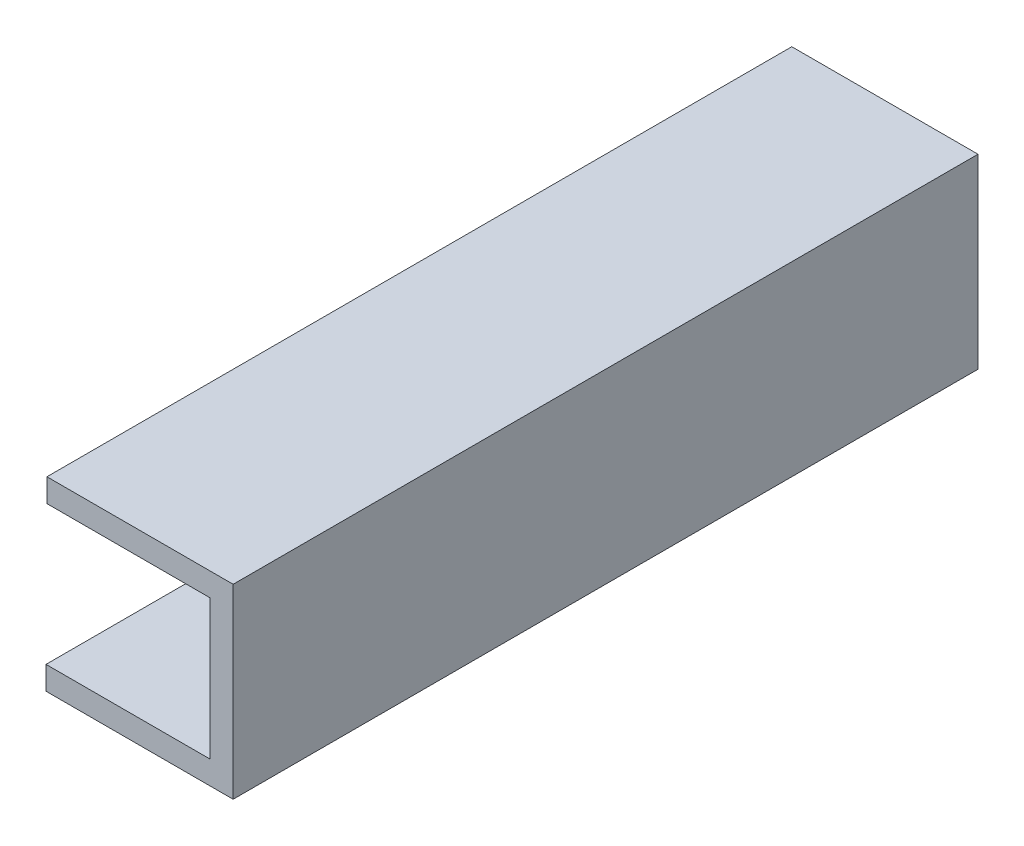
from build123d import *

# Parameters (mm, degrees)
BOSS_EXTRUDE2_DEPTH = 101.6


with BuildPart() as part:
    # Sketch1 → Boss-Extrude2 (new body)
    with BuildSketch(Plane.XY):
        Polygon((-35.931581634, 6.840435924), (-35.931581634, 3.665435924), (-13.706581634, 3.665435924), (-13.706581634, -15.384564076), (-36.058581634, -15.384564076), (-36.058581634, -18.559564076), (-10.531581634, -18.559564076), (-10.531581634, 6.840435924), align=None)
    extrude(amount=BOSS_EXTRUDE2_DEPTH)


solid = part.part
